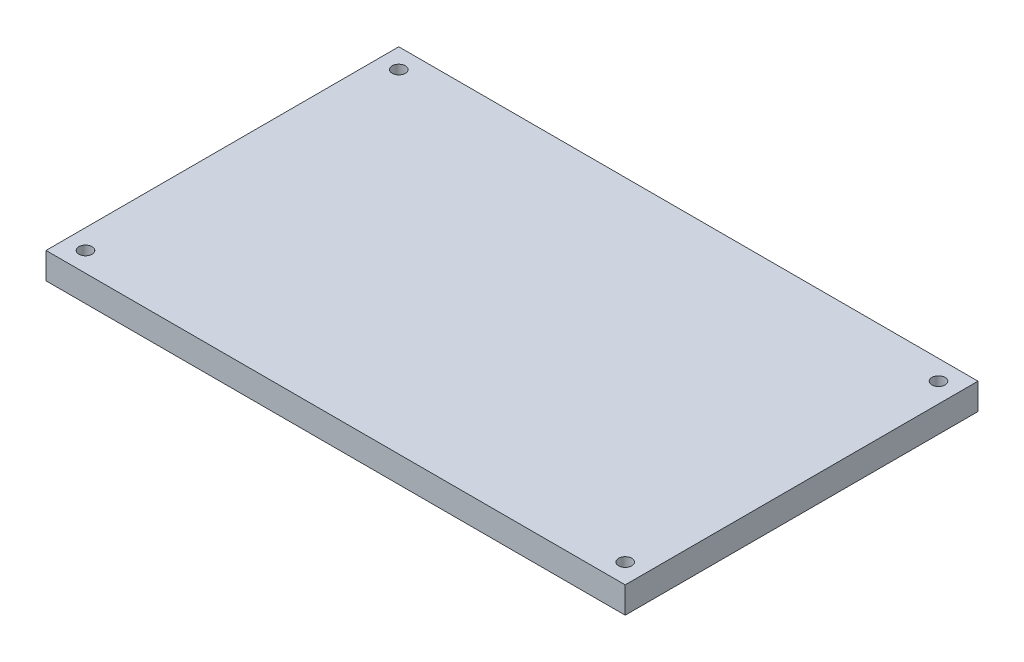
from build123d import *

# Parameters (mm, degrees)
SKETCH2_W           = 139.7
SKETCH2_H           = 85.09
SKETCH2_R           = 1.5875
BOSS_EXTRUDE1_DEPTH = 6.35


with BuildPart() as part:
    # Sketch2 → Boss-Extrude1 (new body)
    with BuildSketch(Plane(origin=(0, 0, 0), x_dir=(1, 0, 0), z_dir=(0, 1, 0))):
        with Locations((69.85, 42.545)):
            Rectangle(SKETCH2_W, SKETCH2_H)
        with Locations(Location((4.7625, 80.3275, 0), (0, 0, 270))):
            Circle(SKETCH2_R, mode=Mode.SUBTRACT)
        with Locations(Location((4.7625, 4.7625, 0), (0, 0, 270))):
            Circle(SKETCH2_R, mode=Mode.SUBTRACT)
        with Locations(Location((134.9375, 4.7625, 0), (0, 0, 270))):
            Circle(SKETCH2_R, mode=Mode.SUBTRACT)
        with Locations(Location((134.9375, 80.3275, 0), (0, 0, 270))):
            Circle(SKETCH2_R, mode=Mode.SUBTRACT)
    extrude(amount=BOSS_EXTRUDE1_DEPTH)


solid = part.part
